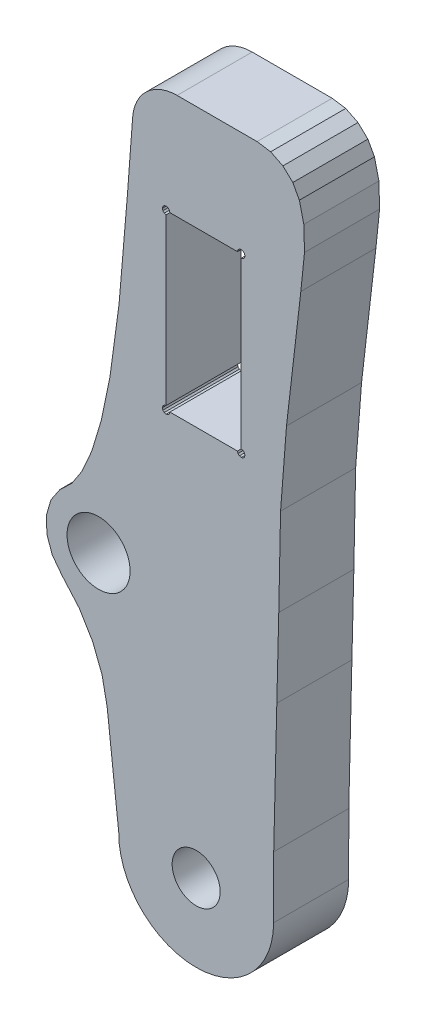
from build123d import *

# Parameters (mm, degrees)
ESQUISSE1_R        = 2.1
ESQUISSE1_R_2      = 1.6
BOSS_EXTRU_1_DEPTH = 5


with BuildPart() as part:
    # Esquisse1 → Boss.-Extru.1 (new body)
    with BuildSketch(Plane.XY.offset(5)):
        with BuildLine():
            Line((21.663586585, 9.246660578), (21.65632273, 5.149368071))
            ThreePointArc((21.65632273, 5.149368071), (16.472816032, -0.006118111), (11.343954037, 5.203733528))
            Line((11.343954037, 5.203733528), (10.574629149, 12.042199031))
            Line((10.574629149, 12.042199031), (10.233579176, 13.737028894))
            Line((10.233579176, 13.737028894), (9.605716227, 15.347798765))
            Line((9.605716227, 15.347798765), (8.709809299, 16.826348646))
            Line((8.709809299, 16.826348646), (7.572636391, 18.128508541))
            Line((7.572636391, 18.128508541), (6.918936443, 18.989558472))
            Line((6.918936443, 18.989558472), (6.559190472, 20.00903839))
            Line((6.559190472, 20.00903839), (6.527723475, 21.089658303))
            Line((6.527723475, 21.089658303), (6.827536451, 22.128338219))
            Line((6.827536451, 22.128338219), (7.430024402, 23.025968147))
            Line((7.430024402, 23.025968147), (8.20419734, 23.752548088))
            Line((8.20419734, 23.752548088), (8.890967284, 24.798538004))
            Line((8.890967284, 24.798538004), (9.556249231, 26.311877882))
            Line((9.556249231, 26.311877882), (10.18684918, 28.409207714))
            Line((10.18684918, 28.409207714), (10.765999134, 31.224477487))
            Line((10.765999134, 31.224477487), (11.369489085, 35.732217124))
            Line((11.369489085, 35.732217124), (11.92756904, 42.336066593))
            Line((11.92756904, 42.336066593), (12.268069386, 46.901117167))
            ThreePointArc((12.268069386, 46.901117167), (13.209278732, 48.85686853), (15.229621264, 49.649998078))
            Line((15.229621264, 49.649998078), (20.556119459, 49.649998078))
            Line((20.556119459, 49.649998078), (21.457249103, 49.511456244))
            Line((21.457249103, 49.511456244), (22.275158213, 49.108634602))
            Line((22.275158213, 49.108634602), (22.93428687, 48.478733303))
            Line((22.93428687, 48.478733303), (23.373775199, 47.679942467))
            Line((23.373775199, 47.679942467), (23.668052623, 46.433641965))
            Line((23.668052623, 46.433641965), (23.713799348, 44.835742))
            Line((23.713799348, 44.835742), (23.469414511, 42.463982691))
            Line((23.469414511, 42.463982691), (22.514057727, 34.22916531))
            Line((22.514057727, 34.22916531), (22.119847298, 29.119826528))
            Line((22.119847298, 29.119826528), (22.000035211, 23.212167249))
            Line((22.000035211, 23.212167249), (21.870164382, 17.918027941))
            Line((21.870164382, 17.918027941), (21.663586585, 9.246660578))
        make_face()
        with Locations((9.999996695, 20.649998987)):
            Circle(ESQUISSE1_R, mode=Mode.SUBTRACT)
        with Locations((16.499999118, 5.150133907)):
            Circle(ESQUISSE1_R_2, mode=Mode.SUBTRACT)
        Polygon((14.249998853, 42.649996567), (14.28348885, 42.774996557), (14.374998843, 42.86649655), (14.499998833, 42.899996547), (14.624998823, 42.86649655), (14.716508816, 42.774996557), (14.749998813, 42.649996567), (19.249998451, 42.649996567), (19.283488448, 42.774996557), (19.374998441, 42.86649655), (19.499998431, 42.899996547), (19.624998421, 42.86649655), (19.716508413, 42.774996557), (19.74999841, 42.649996567), (19.716508413, 42.524996577), (19.624998421, 42.433486585), (19.499998431, 42.399996588), (19.499998431, 31.399997473), (19.624998421, 31.366497476), (19.716508413, 31.274997483), (19.74999841, 31.149997493), (19.716508413, 31.024997503), (19.624998421, 30.93348751), (19.499998431, 30.899997513), (19.374998441, 30.93348751), (19.283488448, 31.024997503), (19.249998451, 31.149997493), (14.749998813, 31.149997493), (14.716508816, 31.024997503), (14.624998823, 30.93348751), (14.499998833, 30.899997513), (14.374998843, 30.93348751), (14.28348885, 31.024997503), (14.249998853, 31.149997493), (14.28348885, 31.274997483), (14.374998843, 31.366497476), (14.499998833, 31.399997473), (14.499998833, 42.399996588), (14.374998843, 42.433486585), (14.28348885, 42.524996577), align=None, mode=Mode.SUBTRACT)
    extrude(amount=-BOSS_EXTRU_1_DEPTH)


solid = part.part
